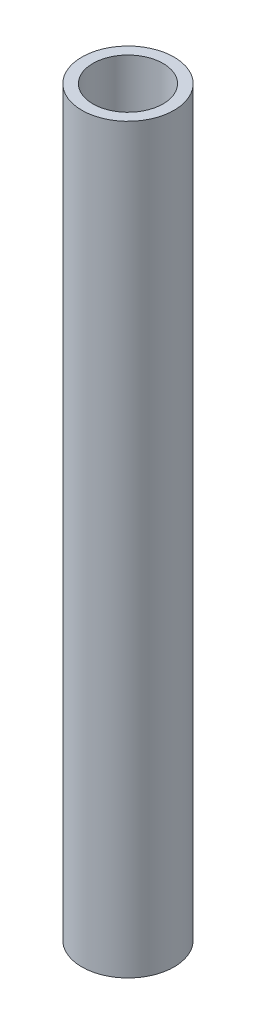
from build123d import *

# Parameters (mm, degrees)
SKETCH1_R           = 2.3
SKETCH1_R_2         = 1.75
BOSS_EXTRUDE1_DEPTH = 18.5


with BuildPart() as part:
    # Sketch1 → Boss-Extrude1 (new, symmetric)
    with BuildSketch(Plane(origin=(0, 0, 0), x_dir=(1, 0, 0), z_dir=(0, 1, 0))):
        with Locations(Location((0, 0, 0), (0, 0, 270))):
            Circle(SKETCH1_R)
        with Locations(Location((0, 0, 0), (0, 0, 270))):
            Circle(SKETCH1_R_2, mode=Mode.SUBTRACT)
    extrude(amount=BOSS_EXTRUDE1_DEPTH, both=True)


solid = part.part
